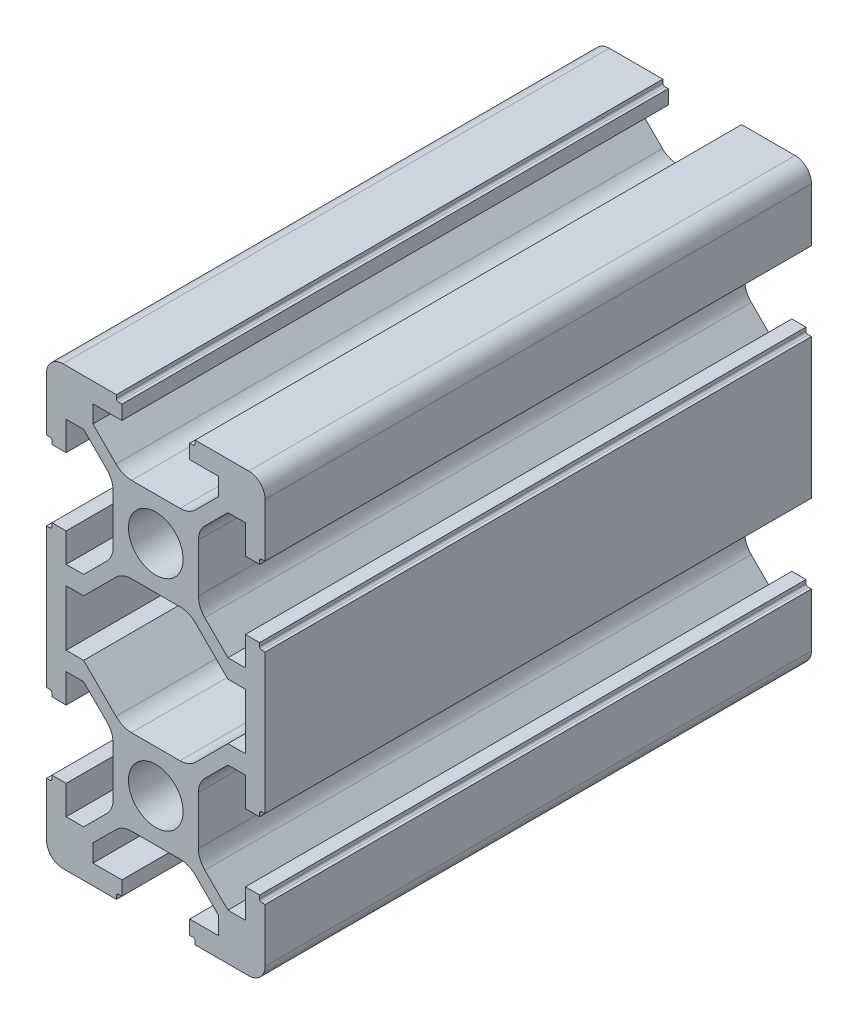
from build123d import *

# Parameters (mm, degrees)
CROQUIS3_R              = 2.5
SALIENTE_EXTRUIR3_DEPTH = 175
SKETCH1_W               = 4.862742591
SKETCH1_H               = 300
SKETCH1_W_2             = 1.5
SKETCH1_W_3             = 0.035786438
CUT_EXTRUDE3_DEPTH      = 100


with BuildPart() as part:
    # Croquis3 → Saliente-Extruir3 (new, symmetric)
    with BuildSketch(Plane.XY):
        with BuildLine():
            Line((-9.5, -13.101470971), (-9.5, -13.401470971))
            ThreePointArc((-9.5, -13.401470971), (-9.558578644, -13.542892327), (-9.7, -13.601470971))
            Line((-9.7, -13.601470971), (-10, -13.601470971))
            Line((-10, -13.601470971), (-10, -18.5))
            ThreePointArc((-10, -18.5), (-9.560660172, -19.560660172), (-8.5, -20))
            Line((-8.5, -20), (-3.601470971, -20))
            Line((-3.601470971, -20), (-3.601470971, -19.7))
            ThreePointArc((-3.601470971, -19.7), (-3.542892327, -19.558578644), (-3.401470971, -19.5))
            Line((-3.401470971, -19.5), (-3.101470971, -19.5))
            Line((-3.101470971, -19.5), (-3.101470971, -18.2))
            Line((-3.101470971, -18.2), (-5.751470971, -18.2))
            Line((-5.751470971, -18.2), (-5.751470971, -16.6))
            Line((-5.751470971, -16.6), (-3.637257409, -14.485786438))
            ThreePointArc((-3.637257409, -14.485786438), (-2.988410711, -14.052240935), (-2.223043846, -13.9))
            Line((-2.223043846, -13.9), (2.223043846, -13.9))
            ThreePointArc((2.223043846, -13.9), (2.988410711, -14.052240935), (3.637257409, -14.485786438))
            Line((3.637257409, -14.485786438), (5.751470971, -16.6))
            Line((5.751470971, -16.6), (5.751470971, -18.2))
            Line((5.751470971, -18.2), (3.101470971, -18.2))
            Line((3.101470971, -18.2), (3.101470971, -19.5))
            Line((3.101470971, -19.5), (3.401470971, -19.5))
            ThreePointArc((3.401470971, -19.5), (3.542892327, -19.558578644), (3.601470971, -19.7))
            Line((3.601470971, -19.7), (3.601470971, -20))
            Line((3.601470971, -20), (8.5, -20))
            ThreePointArc((8.5, -20), (9.560660172, -19.560660172), (10, -18.5))
            Line((10, -18.5), (10, -13.601470971))
            Line((10, -13.601470971), (9.7, -13.601470971))
            ThreePointArc((9.7, -13.601470971), (9.558578644, -13.542892327), (9.5, -13.401470971))
            Line((9.5, -13.401470971), (9.5, -13.101470971))
            Line((9.5, -13.101470971), (8.2, -13.101470971))
            Line((8.2, -13.101470971), (8.2, -15.751470971))
            Line((8.2, -15.751470971), (6.6, -15.751470971))
            Line((6.6, -15.751470971), (4.485786438, -13.637257409))
            ThreePointArc((4.485786438, -13.637257409), (4.052240935, -12.988410711), (3.9, -12.223043846))
            Line((3.9, -12.223043846), (3.9, -7.776956154))
            ThreePointArc((3.9, -7.776956154), (4.052507548, -7.010945946), (4.486771639, -6.361758076))
            Line((4.486771639, -6.361758076), (6.6, -4.251470971))
            Line((6.6, -4.251470971), (8.2, -4.251470971))
            Line((8.2, -4.251470971), (8.2, -6.901470971))
            Line((8.2, -6.901470971), (9.5, -6.901470971))
            Line((9.5, -6.901470971), (9.5, -6.601470971))
            ThreePointArc((9.5, -6.601470971), (9.558578644, -6.460049615), (9.7, -6.401470971))
            Line((9.7, -6.401470971), (10, -6.401470971))
            Line((10, -6.401470971), (10, 6.401470971))
            Line((10, 6.401470971), (9.7, 6.401470971))
            ThreePointArc((9.7, 6.401470971), (9.558578644, 6.460049615), (9.5, 6.601470971))
            Line((9.5, 6.601470971), (9.5, 6.901470971))
            Line((9.5, 6.901470971), (8.2, 6.901470971))
            Line((8.2, 6.901470971), (8.2, 4.251470971))
            Line((8.2, 4.251470971), (6.6, 4.251470971))
            Line((6.6, 4.251470971), (4.486771639, 6.361758076))
            ThreePointArc((4.486771639, 6.361758076), (4.052507548, 7.010945946), (3.9, 7.776956154))
            Line((3.9, 7.776956154), (3.9, 12.223043846))
            ThreePointArc((3.9, 12.223043846), (4.052240935, 12.988410711), (4.485786438, 13.637257409))
            Line((4.485786438, 13.637257409), (6.6, 15.751470971))
            Line((6.6, 15.751470971), (8.2, 15.751470971))
            Line((8.2, 15.751470971), (8.2, 13.101470971))
            Line((8.2, 13.101470971), (9.5, 13.101470971))
            Line((9.5, 13.101470971), (9.5, 13.401470971))
            ThreePointArc((9.5, 13.401470971), (9.558578644, 13.542892327), (9.7, 13.601470971))
            Line((9.7, 13.601470971), (10, 13.601470971))
            Line((10, 13.601470971), (10, 18.5))
            ThreePointArc((10, 18.5), (9.560660172, 19.560660172), (8.5, 20))
            Line((8.5, 20), (3.601470971, 20))
            Line((3.601470971, 20), (3.601470971, 19.7))
            ThreePointArc((3.601470971, 19.7), (3.542892327, 19.558578644), (3.401470971, 19.5))
            Line((3.401470971, 19.5), (3.101470971, 19.5))
            Line((3.101470971, 19.5), (3.101470971, 18.2))
            Line((3.101470971, 18.2), (5.751470971, 18.2))
            Line((5.751470971, 18.2), (5.751470971, 16.6))
            Line((5.751470971, 16.6), (3.637257409, 14.485786438))
            ThreePointArc((3.637257409, 14.485786438), (2.988410711, 14.052240935), (2.223043846, 13.9))
            Line((2.223043846, 13.9), (-2.223043846, 13.9))
            ThreePointArc((-2.223043846, 13.9), (-2.988410711, 14.052240935), (-3.637257409, 14.485786438))
            Line((-3.637257409, 14.485786438), (-5.751470971, 16.6))
            Line((-5.751470971, 16.6), (-5.751470971, 18.2))
            Line((-5.751470971, 18.2), (-3.101470971, 18.2))
            Line((-3.101470971, 18.2), (-3.101470971, 19.5))
            Line((-3.101470971, 19.5), (-3.401470971, 19.5))
            ThreePointArc((-3.401470971, 19.5), (-3.542892327, 19.558578644), (-3.601470971, 19.7))
            Line((-3.601470971, 19.7), (-3.601470971, 20))
            Line((-3.601470971, 20), (-8.5, 20))
            ThreePointArc((-8.5, 20), (-9.560660172, 19.560660172), (-10, 18.5))
            Line((-10, 18.5), (-10, 13.601470971))
            Line((-10, 13.601470971), (-9.7, 13.601470971))
            ThreePointArc((-9.7, 13.601470971), (-9.558578644, 13.542892327), (-9.5, 13.401470971))
            Line((-9.5, 13.401470971), (-9.5, 13.101470971))
            Line((-9.5, 13.101470971), (-8.2, 13.101470971))
            Line((-8.2, 13.101470971), (-8.2, 15.751470971))
            Line((-8.2, 15.751470971), (-6.6, 15.751470971))
            Line((-6.6, 15.751470971), (-4.485786438, 13.637257409))
            ThreePointArc((-4.485786438, 13.637257409), (-4.052240935, 12.988410711), (-3.9, 12.223043846))
            Line((-3.9, 12.223043846), (-3.9, 7.776956154))
            ThreePointArc((-3.9, 7.776956154), (-4.052507548, 7.010945946), (-4.486771639, 6.361758076))
            Line((-4.486771639, 6.361758076), (-6.6, 4.251470971))
            Line((-6.6, 4.251470971), (-8.2, 4.251470971))
            Line((-8.2, 4.251470971), (-8.2, 6.901470971))
            Line((-8.2, 6.901470971), (-9.5, 6.901470971))
            Line((-9.5, 6.901470971), (-9.5, 6.601470971))
            ThreePointArc((-9.5, 6.601470971), (-9.558578644, 6.460049615), (-9.7, 6.401470971))
            Line((-9.7, 6.401470971), (-10, 6.401470971))
            Line((-10, 6.401470971), (-10, -6.401470971))
            Line((-10, -6.401470971), (-9.7, -6.401470971))
            ThreePointArc((-9.7, -6.401470971), (-9.558578644, -6.460049615), (-9.5, -6.601470971))
            Line((-9.5, -6.601470971), (-9.5, -6.901470971))
            Line((-9.5, -6.901470971), (-8.2, -6.901470971))
            Line((-8.2, -6.901470971), (-8.2, -4.251470971))
            Line((-8.2, -4.251470971), (-6.6, -4.251470971))
            Line((-6.6, -4.251470971), (-4.486771639, -6.361758076))
            ThreePointArc((-4.486771639, -6.361758076), (-4.052507548, -7.010945946), (-3.9, -7.776956154))
            Line((-3.9, -7.776956154), (-3.9, -12.223043846))
            ThreePointArc((-3.9, -12.223043846), (-4.052240935, -12.988410711), (-4.485786438, -13.637257409))
            Line((-4.485786438, -13.637257409), (-6.6, -15.751470971))
            Line((-6.6, -15.751470971), (-8.2, -15.751470971))
            Line((-8.2, -15.751470971), (-8.2, -13.101470971))
            Line((-8.2, -13.101470971), (-9.5, -13.101470971))
        make_face()
        with Locations((0, -10)):
            Circle(CROQUIS3_R, mode=Mode.SUBTRACT)
        with Locations(Location((0, 10, 0), (0, 0, 180))):
            Circle(CROQUIS3_R, mode=Mode.SUBTRACT)
        with BuildLine():
            Line((-3.636272208, -5.515198077), (-6.6, -2.555595292))
            Line((-6.6, -2.555595292), (-8.2, -2.555595292))
            Line((-8.2, -2.555595292), (-8.2, 2.555595292))
            Line((-8.2, 2.555595292), (-6.6, 2.555595292))
            Line((-6.6, 2.555595292), (-3.636272208, 5.515198077))
            ThreePointArc((-3.636272208, 5.515198077), (-2.987767275, 5.948025454), (-2.223043846, 6.1))
            Line((-2.223043846, 6.1), (2.223043846, 6.1))
            ThreePointArc((2.223043846, 6.1), (2.987767275, 5.948025454), (3.636272208, 5.515198077))
            Line((3.636272208, 5.515198077), (6.6, 2.555595292))
            Line((6.6, 2.555595292), (8.2, 2.555595292))
            Line((8.2, 2.555595292), (8.2, -2.555595292))
            Line((8.2, -2.555595292), (6.6, -2.555595292))
            Line((6.6, -2.555595292), (3.636272208, -5.515198077))
            ThreePointArc((3.636272208, -5.515198077), (2.987767275, -5.948025454), (2.223043846, -6.1))
            Line((2.223043846, -6.1), (-2.223043846, -6.1))
            ThreePointArc((-2.223043846, -6.1), (-2.987767275, -5.948025454), (-3.636272208, -5.515198077))
        make_face(mode=Mode.SUBTRACT)
    extrude(amount=SALIENTE_EXTRUIR3_DEPTH, both=True)

    # Sketch1 → Cut-Extrude3 (cut)
    with BuildSketch(Plane(origin=(0, 20, 0), x_dir=(1, 0, 0), z_dir=(0, 1, 0))):
        Polygon((3.637257409, -175), (8.5, -175), (10, -175), (10, 125), (3.637257409, 125), align=None)
        Polygon((2.223043846, -175), (3.601470971, -175), (3.601470971, 125), (-3.601470971, 125), (-3.601470971, -175), (-2.223043846, -175), align=None)
        with Locations((-6.068628705, -25)):
            Rectangle(SKETCH1_W, SKETCH1_H)
        with Locations((-9.25, -25)):
            Rectangle(SKETCH1_W_2, SKETCH1_H)
        with Locations((-3.61936419, -25)):
            Rectangle(SKETCH1_W_3, SKETCH1_H)
        with Locations((3.61936419, -25)):
            Rectangle(SKETCH1_W_3, SKETCH1_H)
    extrude(amount=-CUT_EXTRUDE3_DEPTH, mode=Mode.SUBTRACT)


solid = part.part
